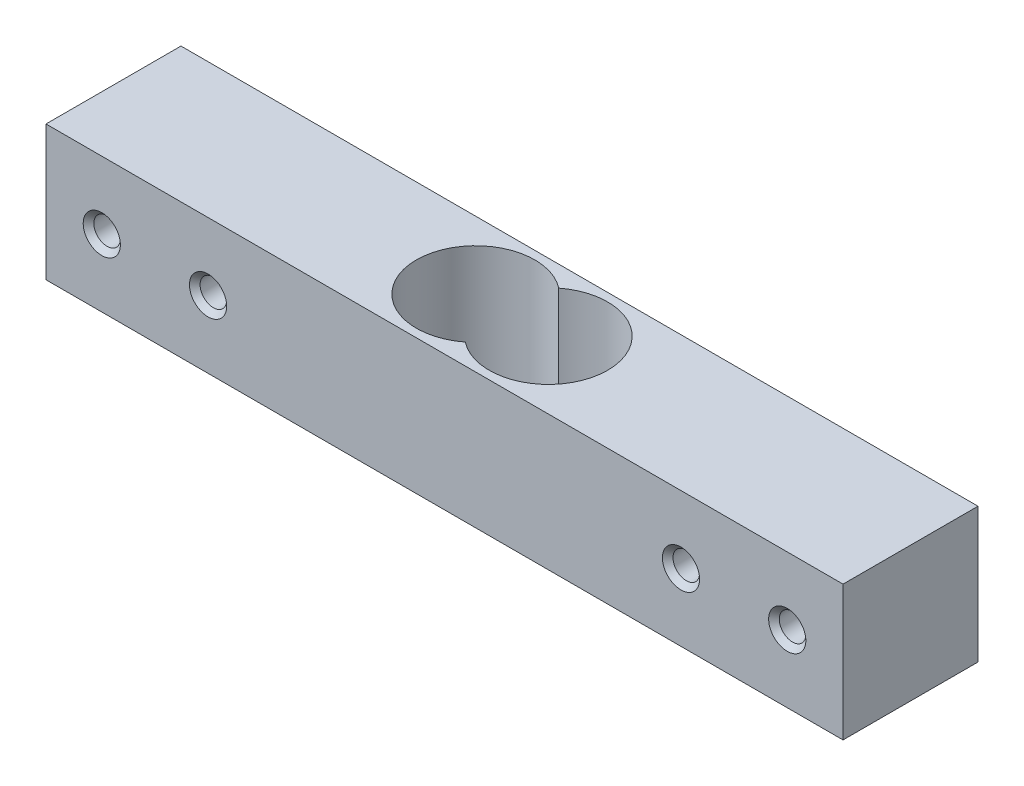
from build123d import *

# Parameters (mm, degrees)
SKETCH1_W                  = 75
SKETCH1_H                  = 12.7
BOSS_EXTRUDE1_DEPTH        = 6.35
M3_TAPPED_HOLE1_AT_2_COUNT = 2
M3_TAPPED_HOLE1_AT_2_PITCH = 10
M3_TAPPED_HOLE1_AT_3_COUNT = 2
M3_TAPPED_HOLE1_AT_3_PITCH = 54.5
M3_TAPPED_HOLE1_AT_4_COUNT = 2
M3_TAPPED_HOLE1_AT_4_PITCH = 64.5


with BuildPart() as part:
    # Sketch1 → Boss-Extrude1 (new, symmetric)
    with BuildSketch(Plane(origin=(0, 0, 0), x_dir=(1, 0, 0), z_dir=(0, 1, 0))):
        Rectangle(SKETCH1_W, SKETCH1_H)
        with BuildLine():
            ThreePointArc((0, -4.39886349), (-9, 0), (0, 4.39886349))
            ThreePointArc((0, 4.39886349), (5.873085987, 5.008742357), (9, 0))
            ThreePointArc((9, 0), (5.873085987, -5.008742357), (0, -4.39886349))
        make_face(mode=Mode.SUBTRACT)
    extrude(amount=BOSS_EXTRUDE1_DEPTH, both=True)

    # Sketch5 → M3 Tapped Hole1 (revolve, cut)
    with BuildSketch(Plane(origin=(-32.25, 0, -6.35), x_dir=(0, 1, 0), z_dir=(1, 0, 0))):
        Polygon((0, 0), (0, 12.7), (1.75, 12.7), (1.25, 12.2), (1.25, 0.5), (1.75, 0), align=None)
    m3_tapped_hole1 = revolve(axis=Axis((-32.25, 0, -12.7), (0, 0, 1)), mode=Mode.SUBTRACT)

    # M3 Tapped Hole1 at 2: M3 Tapped Hole1 ×2
    with Locations(*[(i * M3_TAPPED_HOLE1_AT_2_PITCH, 0, 0) for i in range(1, M3_TAPPED_HOLE1_AT_2_COUNT)]):
        add(m3_tapped_hole1, mode=Mode.SUBTRACT)

    # M3 Tapped Hole1 at 3: M3 Tapped Hole1 ×2
    with Locations(*[(i * M3_TAPPED_HOLE1_AT_3_PITCH, 0, 0) for i in range(1, M3_TAPPED_HOLE1_AT_3_COUNT)]):
        add(m3_tapped_hole1, mode=Mode.SUBTRACT)

    # M3 Tapped Hole1 at 4: M3 Tapped Hole1 ×2
    with Locations(*[(i * M3_TAPPED_HOLE1_AT_4_PITCH, 0, 0) for i in range(1, M3_TAPPED_HOLE1_AT_4_COUNT)]):
        add(m3_tapped_hole1, mode=Mode.SUBTRACT)


solid = part.part
